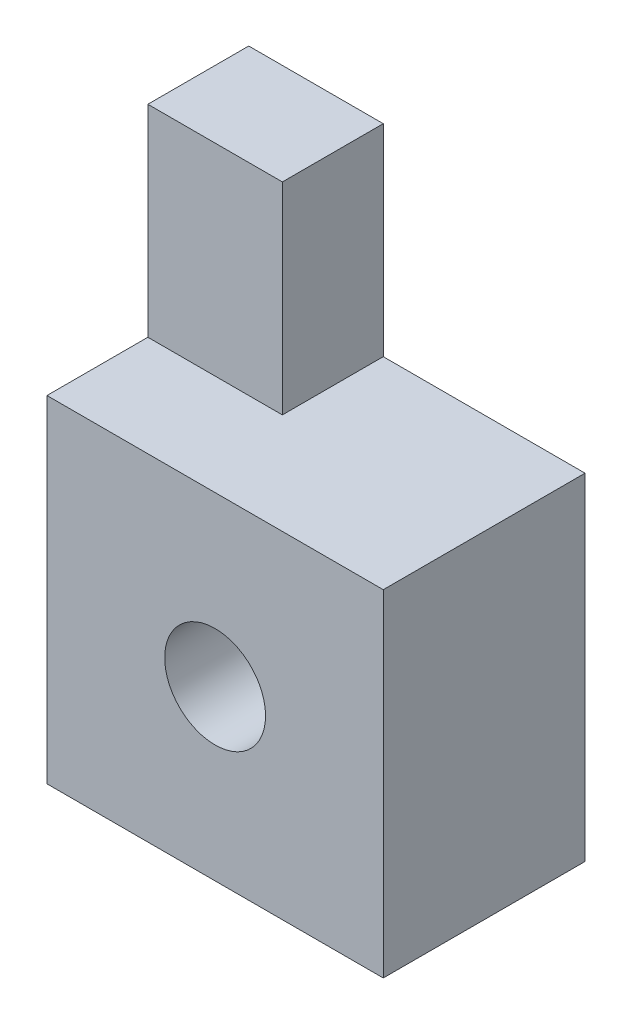
from build123d import *

# Parameters (mm, degrees)
SKETCH1_W           = 50
SKETCH1_H           = 50
BOSS_EXTRUDE1_DEPTH = 30
CUT_EXTRUDE1_REACH  = 48.368
SKETCH2_R           = 7.5
SKETCH4_W           = 20
SKETCH4_H           = 15
BOSS_EXTRUDE3_DEPTH = 30


with BuildPart() as part:
    # Sketch1 → Boss-Extrude1 (new body)
    with BuildSketch(Plane.XY):
        Rectangle(SKETCH1_W, SKETCH1_H)
    extrude(amount=BOSS_EXTRUDE1_DEPTH)

    # Sketch2 → Cut-Extrude1 (cut, up to next)
    with BuildSketch(Plane.XY.offset(30), mode=Mode.PRIVATE) as cut_extrude1_sk1:
        Circle(SKETCH2_R)
    cut_extrude1_tool1 = extrude(cut_extrude1_sk1.sketch, amount=-CUT_EXTRUDE1_REACH, mode=Mode.PRIVATE) & part.part
    add(cut_extrude1_tool1.solids().sort_by_distance((0, 0, 30))[0], mode=Mode.SUBTRACT)

    # Sketch4 → Boss-Extrude3 (add)
    with BuildSketch(Plane(origin=(0, 25, 0), x_dir=(1, 0, 0), z_dir=(0, 1, 0))):
        with Locations((-15, -7.5)):
            Rectangle(SKETCH4_W, SKETCH4_H)
    extrude(amount=BOSS_EXTRUDE3_DEPTH)


solid = part.part
